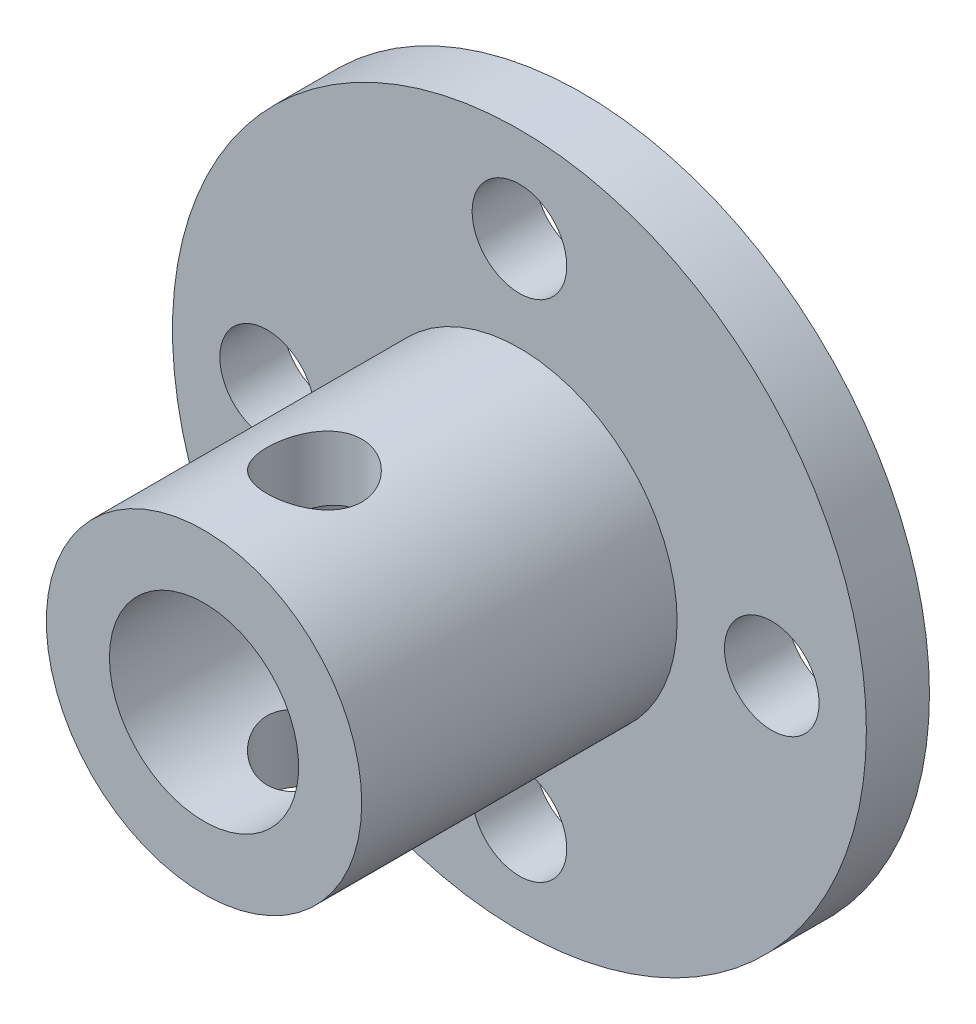
from build123d import *

# Parameters (mm, degrees)
SKETCH_1_R               = 11
EXTRUDE_1_DEPTH          = 2
SKETCH_2_R               = 5
EXTRUDE_2_DEPTH          = 10
SKETCH_3_R               = 3
SKETCH_3_R_2             = 1.5
CUT_EXTRUDE_1_DEPTH      = 12
CUT_EXTRUDE_2_DEPTH      = 12
CUT_EXTRUDE_2_DEPTH_BACK = 12
SKETCH_4_R               = 1.5


with BuildPart() as part:
    # 草图1 → 凸台-拉伸1 (new body)
    with BuildSketch(Plane.XY):
        Circle(SKETCH_1_R)
    extrude(amount=EXTRUDE_1_DEPTH)

    # 草图2 → 凸台-拉伸2 (add)
    with BuildSketch(Plane.XY.offset(2)):
        Circle(SKETCH_2_R)
    extrude(amount=EXTRUDE_2_DEPTH)

    # 草图3 → 切除-拉伸1 (cut)
    with BuildSketch(Plane(origin=(0, 0, 0), x_dir=(-1, 0, 0), z_dir=(0, 0, -1))):
        Circle(SKETCH_3_R)
        with Locations((0, 8)):
            Circle(SKETCH_3_R_2)
        with Locations((8, 0)):
            Circle(SKETCH_3_R_2)
        with Locations((0, -8)):
            Circle(SKETCH_3_R_2)
        with Locations((-8, 0)):
            Circle(SKETCH_3_R_2)
    extrude(amount=-CUT_EXTRUDE_1_DEPTH, mode=Mode.SUBTRACT)

    # 草图4 → 切除-拉伸2 (cut, two sides: drawn at the far end of the back side and taken through both)
    with BuildSketch(Plane(origin=(0, 0, 0), x_dir=(1, 0, 0), z_dir=(0, 1, 0)).offset(-CUT_EXTRUDE_2_DEPTH_BACK)):
        with Locations((0, -8.5)):
            Circle(SKETCH_4_R)
    extrude(amount=CUT_EXTRUDE_2_DEPTH + CUT_EXTRUDE_2_DEPTH_BACK, mode=Mode.SUBTRACT)


solid = part.part
